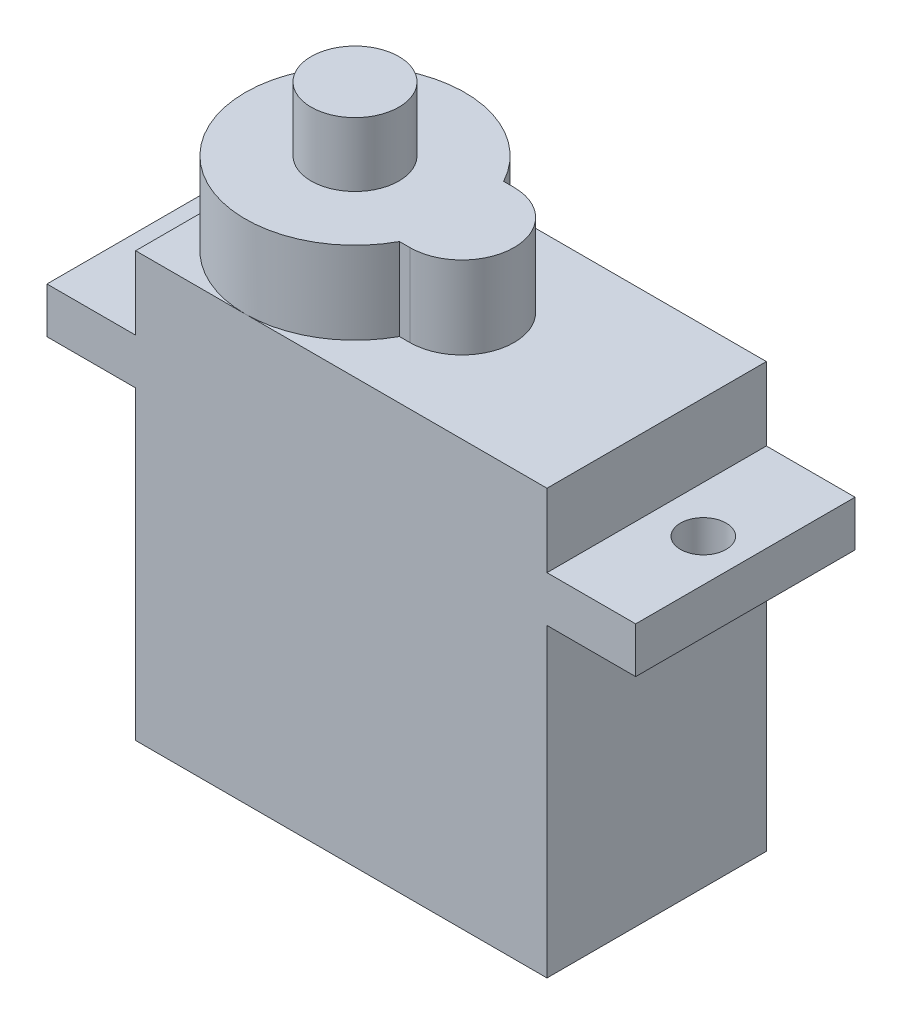
from build123d import *

# Parameters (mm, degrees)
SKETCH1_R          = 2.4
EXTRUDE_269_DEPTH  = 3.5
EXTRUDE_450_DEPTH  = 4.5
SKETCH3_W          = 22.5
SKETCH3_H          = 12
EXTRUDE_686_DEPTH  = 23.2
SKETCH4_W          = 32.2
SKETCH4_H          = 12
EXTRUDE_857_DEPTH  = 2.5
SKETCH5_R          = 1.25
CUT_EXTRUDE1_DEPTH = 36.483975256


with BuildPart() as part:
    # Sketch1 → Extrude 269 (new body)
    with BuildSketch(Plane(origin=(0, 0, 0), x_dir=(1, 0, 0), z_dir=(0, 1, 0))):
        with Locations(Location((0, 0, 0), (0, 0, 270))):
            Circle(SKETCH1_R)
    extrude(amount=EXTRUDE_269_DEPTH)

    # Sketch2 → Extrude 450 (add)
    with BuildSketch(Plane(origin=(0, 0, 0), x_dir=(1, 0, 0), z_dir=(0, 1, 0))):
        with BuildLine():
            Line((5.85, -2.85), (5.279914772, -2.85))
            ThreePointArc((5.279914772, -2.85), (-6, 0), (5.279914772, 2.85))
            Line((5.279914772, 2.85), (5.85, 2.85))
            ThreePointArc((5.85, 2.85), (8.7, 0), (5.85, -2.85))
        make_face()
    extrude(amount=-EXTRUDE_450_DEPTH)

    # Sketch3 → Extrude 686 (add)
    with BuildSketch(Plane(origin=(0, -4.5, 0), x_dir=(-1, 0, 0), z_dir=(0, -1, 0))):
        with Locations((-5.25, 0)):
            Rectangle(SKETCH3_W, SKETCH3_H)
    extrude(amount=EXTRUDE_686_DEPTH)

    # Sketch4 → Extrude 857 (add)
    with BuildSketch(Plane(origin=(0, -8.5, 0), x_dir=(1, 0, 0), z_dir=(0, 1, 0))):
        with Locations((5.25, 0)):
            Rectangle(SKETCH4_W, SKETCH4_H)
    extrude(amount=-EXTRUDE_857_DEPTH)

    # Sketch5 → Cut-Extrude1 (cut, through all)
    with BuildSketch(Plane(origin=(0, 0, 0), x_dir=(1, 0, 0), z_dir=(0, 1, 0))):
        with Locations(Location((-8.55, 0, 0), (0, 0, 90))):
            Circle(SKETCH5_R)
        with Locations(Location((19.05, 0, 0), (0, 0, 90))):
            Circle(SKETCH5_R)
    extrude(amount=-CUT_EXTRUDE1_DEPTH, mode=Mode.SUBTRACT)


solid = part.part
